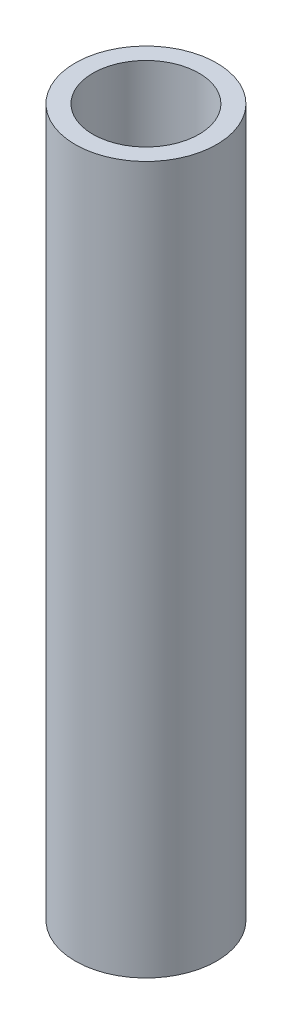
from build123d import *

# Parameters (mm, degrees)
SKETCH_1_R      = 4
SKETCH_1_R_2    = 3
EXTRUDE_1_DEPTH = 40


with BuildPart() as part:
    # 草图1 → 凸台-拉伸1 (new body)
    with BuildSketch(Plane(origin=(0, 0, 0), x_dir=(1, 0, 0), z_dir=(0, 1, 0))):
        with Locations(Location((0, 0, 0), (0, 0, 270))):
            Circle(SKETCH_1_R)
        with Locations(Location((0, 0, 0), (0, 0, 270))):
            Circle(SKETCH_1_R_2, mode=Mode.SUBTRACT)
    extrude(amount=EXTRUDE_1_DEPTH)


solid = part.part
